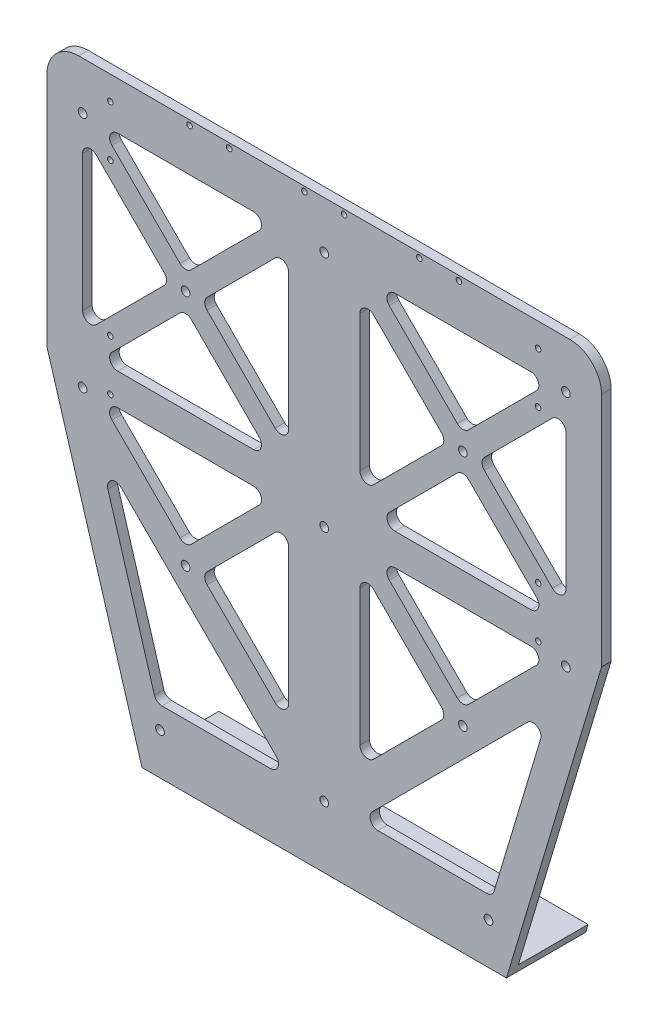
from build123d import *

# Parameters (mm, degrees)
SKETCH_1_W               = 350
SKETCH_1_H               = 50
SKETCH_1_R               = 2.75
EXTRUDE_1_DEPTH          = 5
SKETCH_2_W               = 350
SKETCH_2_H               = 6
EXTRUDE_2_DEPTH          = 364
SKETCH_3_R               = 2.75
CUT_EXTRUDE_1_DEPTH      = 500
SKETCH_4_R               = 1.75
CUT_EXTRUDE_2_DEPTH      = 10
FILLET_1_R               = 20
CUT_EXTRUDE_4_DEPTH      = 411.7578362
CUT_EXTRUDE_4_DEPTH_BACK = 411.7578362
CUT_EXTRUDE_5_DEPTH      = 10
SKETCH_10_R              = 2.75
CUT_EXTRUDE_6_DEPTH      = 10
SKETCH_11_R              = 1.75
CUT_EXTRUDE_7_DEPTH      = 10


with BuildPart() as part:
    # 草图1 → 凸台-拉伸1 (new body)
    with BuildSketch(Plane(origin=(0, 0, 0), x_dir=(1, 0, 0), z_dir=(0, 1, 0))):
        with Locations((0, 25)):
            Rectangle(SKETCH_1_W, SKETCH_1_H)
        with Locations(Location((130, 25, 0), (0, 0, 270))):
            Circle(SKETCH_1_R, mode=Mode.SUBTRACT)
        with Locations(Location((50, 25, 0), (0, 0, 270))):
            Circle(SKETCH_1_R, mode=Mode.SUBTRACT)
        with Locations(Location((-130, 25, 0), (0, 0, 90))):
            Circle(SKETCH_1_R, mode=Mode.SUBTRACT)
        with Locations(Location((-50, 25, 0), (0, 0, 90))):
            Circle(SKETCH_1_R, mode=Mode.SUBTRACT)
        with Locations(Location((10, 25, 0), (0, 0, 270))):
            Circle(SKETCH_1_R, mode=Mode.SUBTRACT)
        with Locations(Location((90, 25, 0), (0, 0, 270))):
            Circle(SKETCH_1_R, mode=Mode.SUBTRACT)
        with Locations(Location((-90, 25, 0), (0, 0, 90))):
            Circle(SKETCH_1_R, mode=Mode.SUBTRACT)
        with Locations(Location((-10, 25, 0), (0, 0, 90))):
            Circle(SKETCH_1_R, mode=Mode.SUBTRACT)
    extrude(amount=EXTRUDE_1_DEPTH)

    # 草图2 → 凸台-拉伸2 (add)
    with BuildSketch(Plane(origin=(0, 5, 0), x_dir=(1, 0, 0), z_dir=(0, 1, 0))):
        with Locations((0, 3)):
            Rectangle(SKETCH_2_W, SKETCH_2_H)
    extrude(amount=EXTRUDE_2_DEPTH)

    # 草图3 → 切除-拉伸1 (cut)
    with BuildSketch(Plane(origin=(0, 0, -6), x_dir=(-1, 0, 0), z_dir=(0, 0, -1))):
        with Locations((87.5, 274)):
            Circle(SKETCH_3_R)
        with Locations((87.5, 124)):
            Circle(SKETCH_3_R)
        with Locations((-87.5, 124)):
            Circle(SKETCH_3_R)
        with Locations((-87.5, 274)):
            Circle(SKETCH_3_R)
        with Locations((152.5, 339)):
            Circle(SKETCH_3_R)
        with Locations((152.5, 189)):
            Circle(SKETCH_3_R)
        with Locations((152.5, 39)):
            Circle(SKETCH_3_R)
        with Locations((-152.5, 39)):
            Circle(SKETCH_3_R)
        with Locations((-152.5, 189)):
            Circle(SKETCH_3_R)
        with Locations((-152.5, 339)):
            Circle(SKETCH_3_R)
        with Locations((0, 339)):
            Circle(SKETCH_3_R)
        with Locations((0, 189)):
            Circle(SKETCH_3_R)
        with Locations((0, 39)):
            Circle(SKETCH_3_R)
        with BuildLine():
            Line((83.964466094, 137.535533906), (41.035533906, 180.464466094))
            ThreePointArc((41.035533906, 180.464466094), (39.951670149, 185.913417162), (44.571067812, 189))
            Line((44.571067812, 189), (130.428932188, 189))
            ThreePointArc((130.428932188, 189), (135.048329851, 185.913417162), (133.964466094, 180.464466094))
            Line((133.964466094, 180.464466094), (91.035533906, 137.535533906))
            ThreePointArc((91.035533906, 137.535533906), (87.5, 136.071067812), (83.964466094, 137.535533906))
        make_face()
        with BuildLine():
            Line((44.571067812, 339), (130.428932188, 339))
            ThreePointArc((130.428932188, 339), (135.048329851, 335.913417162), (133.964466094, 330.464466094))
            Line((133.964466094, 330.464466094), (91.035533906, 287.535533906))
            ThreePointArc((91.035533906, 287.535533906), (87.5, 286.071067812), (83.964466094, 287.535533906))
            Line((83.964466094, 287.535533906), (41.035533906, 330.464466094))
            ThreePointArc((41.035533906, 330.464466094), (39.951670149, 335.913417162), (44.571067812, 339))
        make_face()
        with BuildLine():
            Line((73.964466094, 120.464466094), (31.035533906, 77.535533906))
            ThreePointArc((31.035533906, 77.535533906), (25.586582838, 76.451670149), (22.5, 81.071067812))
            Line((22.5, 81.071067812), (22.5, 166.928932188))
            ThreePointArc((22.5, 166.928932188), (25.586582838, 171.548329851), (31.035533906, 170.464466094))
            Line((31.035533906, 170.464466094), (73.964466094, 127.535533906))
            ThreePointArc((73.964466094, 127.535533906), (75.428932188, 124), (73.964466094, 120.464466094))
        make_face()
        with BuildLine():
            Line((101.035533906, 277.535533906), (143.964466094, 320.464466094))
            ThreePointArc((143.964466094, 320.464466094), (149.413417162, 321.548329851), (152.5, 316.928932188))
            Line((152.5, 316.928932188), (152.5, 231.071067812))
            ThreePointArc((152.5, 231.071067812), (149.413417162, 226.451670149), (143.964466094, 227.535533906))
            Line((143.964466094, 227.535533906), (101.035533906, 270.464466094))
            ThreePointArc((101.035533906, 270.464466094), (99.571067812, 274), (101.035533906, 277.535533906))
        make_face()
        with BuildLine():
            Line((91.035533906, 260.464466094), (133.964466094, 217.535533906))
            ThreePointArc((133.964466094, 217.535533906), (135.048329851, 212.086582838), (130.428932188, 209))
            Line((130.428932188, 209), (44.571067812, 209))
            ThreePointArc((44.571067812, 209), (39.951670149, 212.086582838), (41.035533906, 217.535533906))
            Line((41.035533906, 217.535533906), (83.964466094, 260.464466094))
            ThreePointArc((83.964466094, 260.464466094), (87.5, 261.928932188), (91.035533906, 260.464466094))
        make_face()
        with BuildLine():
            Line((73.964466094, 270.464466094), (31.035533906, 227.535533906))
            ThreePointArc((31.035533906, 227.535533906), (25.586582838, 226.451670149), (22.5, 231.071067812))
            Line((22.5, 231.071067812), (22.5, 316.928932188))
            ThreePointArc((22.5, 316.928932188), (25.586582838, 321.548329851), (31.035533906, 320.464466094))
            Line((31.035533906, 320.464466094), (73.964466094, 277.535533906))
            ThreePointArc((73.964466094, 277.535533906), (75.428932188, 274), (73.964466094, 270.464466094))
        make_face()
        with BuildLine():
            Line((-91.035533906, 137.535533906), (-133.964466094, 180.464466094))
            ThreePointArc((-133.964466094, 180.464466094), (-135.048329851, 185.913417162), (-130.428932188, 189))
            Line((-130.428932188, 189), (-44.571067812, 189))
            ThreePointArc((-44.571067812, 189), (-39.951670149, 185.913417162), (-41.035533906, 180.464466094))
            Line((-41.035533906, 180.464466094), (-83.964466094, 137.535533906))
            ThreePointArc((-83.964466094, 137.535533906), (-87.5, 136.071067812), (-91.035533906, 137.535533906))
        make_face()
        with BuildLine():
            Line((-73.964466094, 127.535533906), (-31.035533906, 170.464466094))
            ThreePointArc((-31.035533906, 170.464466094), (-25.586582838, 171.548329851), (-22.5, 166.928932188))
            Line((-22.5, 166.928932188), (-22.5, 81.071067812))
            ThreePointArc((-22.5, 81.071067812), (-25.586582838, 76.451670149), (-31.035533906, 77.535533906))
            Line((-31.035533906, 77.535533906), (-73.964466094, 120.464466094))
            ThreePointArc((-73.964466094, 120.464466094), (-75.428932188, 124), (-73.964466094, 127.535533906))
        make_face()
        with BuildLine():
            Line((-91.035533906, 287.535533906), (-133.964466094, 330.464466094))
            ThreePointArc((-133.964466094, 330.464466094), (-135.048329851, 335.913417162), (-130.428932188, 339))
            Line((-130.428932188, 339), (-44.571067812, 339))
            ThreePointArc((-44.571067812, 339), (-39.951670149, 335.913417162), (-41.035533906, 330.464466094))
            Line((-41.035533906, 330.464466094), (-83.964466094, 287.535533906))
            ThreePointArc((-83.964466094, 287.535533906), (-87.5, 286.071067812), (-91.035533906, 287.535533906))
        make_face()
        with BuildLine():
            Line((-101.035533906, 270.464466094), (-143.964466094, 227.535533906))
            ThreePointArc((-143.964466094, 227.535533906), (-149.413417162, 226.451670149), (-152.5, 231.071067812))
            Line((-152.5, 231.071067812), (-152.5, 316.928932188))
            ThreePointArc((-152.5, 316.928932188), (-149.413417162, 321.548329851), (-143.964466094, 320.464466094))
            Line((-143.964466094, 320.464466094), (-101.035533906, 277.535533906))
            ThreePointArc((-101.035533906, 277.535533906), (-99.571067812, 274), (-101.035533906, 270.464466094))
        make_face()
        with BuildLine():
            Line((-73.964466094, 277.535533906), (-31.035533906, 320.464466094))
            ThreePointArc((-31.035533906, 320.464466094), (-25.586582838, 321.548329851), (-22.5, 316.928932188))
            Line((-22.5, 316.928932188), (-22.5, 231.071067812))
            ThreePointArc((-22.5, 231.071067812), (-25.586582838, 226.451670149), (-31.035533906, 227.535533906))
            Line((-31.035533906, 227.535533906), (-73.964466094, 270.464466094))
            ThreePointArc((-73.964466094, 270.464466094), (-75.428932188, 274), (-73.964466094, 277.535533906))
        make_face()
        with BuildLine():
            Line((-83.964466094, 260.464466094), (-41.035533906, 217.535533906))
            ThreePointArc((-41.035533906, 217.535533906), (-39.951670149, 212.086582838), (-44.571067812, 209))
            Line((-44.571067812, 209), (-130.428932188, 209))
            ThreePointArc((-130.428932188, 209), (-135.048329851, 212.086582838), (-133.964466094, 217.535533906))
            Line((-133.964466094, 217.535533906), (-91.035533906, 260.464466094))
            ThreePointArc((-91.035533906, 260.464466094), (-87.5, 261.928932188), (-83.964466094, 260.464466094))
        make_face()
    extrude(amount=-CUT_EXTRUDE_1_DEPTH, mode=Mode.SUBTRACT)

    # 草图4 → 切除-拉伸2 (cut)
    with BuildSketch(Plane.XY):
        with Locations((60, 366)):
            Circle(SKETCH_4_R)
        with Locations((85, 366)):
            Circle(SKETCH_4_R)
        with Locations((12.5, 366)):
            Circle(SKETCH_4_R)
        with Locations((-12.5, 366)):
            Circle(SKETCH_4_R)
        with Locations((-85, 366)):
            Circle(SKETCH_4_R)
        with Locations((-60, 366)):
            Circle(SKETCH_4_R)
    extrude(amount=-CUT_EXTRUDE_2_DEPTH, mode=Mode.SUBTRACT)

    # 圆角1
    fillet_1_edges = [part.edges().sort_by_distance(p)[0] for p in [
        (-175, 369, -3),
        (175, 369, -3),
    ]]
    fillet(fillet_1_edges, radius=FILLET_1_R)

    # 草图8 → 切除-拉伸4 (cut, two sides: drawn at the far end of the back side and taken through both)
    with BuildSketch(Plane(origin=(0, 0, -6), x_dir=(-1, 0, 0), z_dir=(0, 0, -1)).offset(-CUT_EXTRUDE_4_DEPTH_BACK)):
        Polygon((-175, 200), (-115, 0), (-175, 0), align=None)
        Polygon((175, 0), (175, 200), (115, 0), align=None)
    extrude(amount=CUT_EXTRUDE_4_DEPTH + CUT_EXTRUDE_4_DEPTH_BACK, mode=Mode.SUBTRACT)

    # 草图9 → 切除-拉伸5 (cut)
    with BuildSketch(Plane.XY):
        with BuildLine():
            Line((-136.564320012, 141.483110098), (-107.188365154, 43.563260572))
            ThreePointArc((-107.188365154, 43.563260572), (-105.383886376, 40.988535359), (-102.399233728, 40))
            Line((-102.399233728, 40), (-33.855339059, 40))
            ThreePointArc((-33.855339059, 40), (-29.235941397, 43.086582838), (-30.319805153, 48.535533906))
            Line((-30.319805153, 48.535533906), (-128.23965468, 146.455383432))
            ThreePointArc((-128.23965468, 146.455383432), (-134.339121543, 147.212430077), (-136.564320012, 141.483110098))
        make_face()
        with BuildLine():
            Line((30.319805153, 48.535533906), (128.23965468, 146.455383432))
            ThreePointArc((128.23965468, 146.455383432), (134.339121543, 147.212430077), (136.564320012, 141.483110098))
            Line((136.564320012, 141.483110098), (107.188365154, 43.563260572))
            ThreePointArc((107.188365154, 43.563260572), (105.383886376, 40.988535359), (102.399233728, 40))
            Line((102.399233728, 40), (33.855339059, 40))
            ThreePointArc((33.855339059, 40), (29.235941397, 43.086582838), (30.319805153, 48.535533906))
        make_face()
    extrude(amount=-CUT_EXTRUDE_5_DEPTH, mode=Mode.SUBTRACT)

    # 草图10 → 切除-拉伸6 (cut)
    with BuildSketch(Plane(origin=(0, 0, -6), x_dir=(-1, 0, 0), z_dir=(0, 0, -1))):
        with Locations((-103.650859454, 26.169531512)):
            Circle(SKETCH_10_R)
        with Locations((103.650859454, 26.169531512)):
            Circle(SKETCH_10_R)
    extrude(amount=-CUT_EXTRUDE_6_DEPTH, mode=Mode.SUBTRACT)

    # 草图11 → 切除-拉伸7 (cut)
    with BuildSketch(Plane(origin=(0, 0, -6), x_dir=(-1, 0, 0), z_dir=(0, 0, -1))):
        with Locations((-135, 354)):
            Circle(SKETCH_11_R)
        with Locations((-135, 322)):
            Circle(SKETCH_11_R)
        with Locations((-135, 290)):
            Circle(SKETCH_11_R)
        with Locations((-135, 258)):
            Circle(SKETCH_11_R)
        with Locations((-135, 226)):
            Circle(SKETCH_11_R)
        with Locations((-135, 194)):
            Circle(SKETCH_11_R)
        with Locations((135, 194)):
            Circle(SKETCH_11_R)
        with Locations((135, 226)):
            Circle(SKETCH_11_R)
        with Locations((135, 258)):
            Circle(SKETCH_11_R)
        with Locations((135, 290)):
            Circle(SKETCH_11_R)
        with Locations((135, 322)):
            Circle(SKETCH_11_R)
        with Locations((135, 354)):
            Circle(SKETCH_11_R)
    extrude(amount=-CUT_EXTRUDE_7_DEPTH, mode=Mode.SUBTRACT)


solid = part.part
